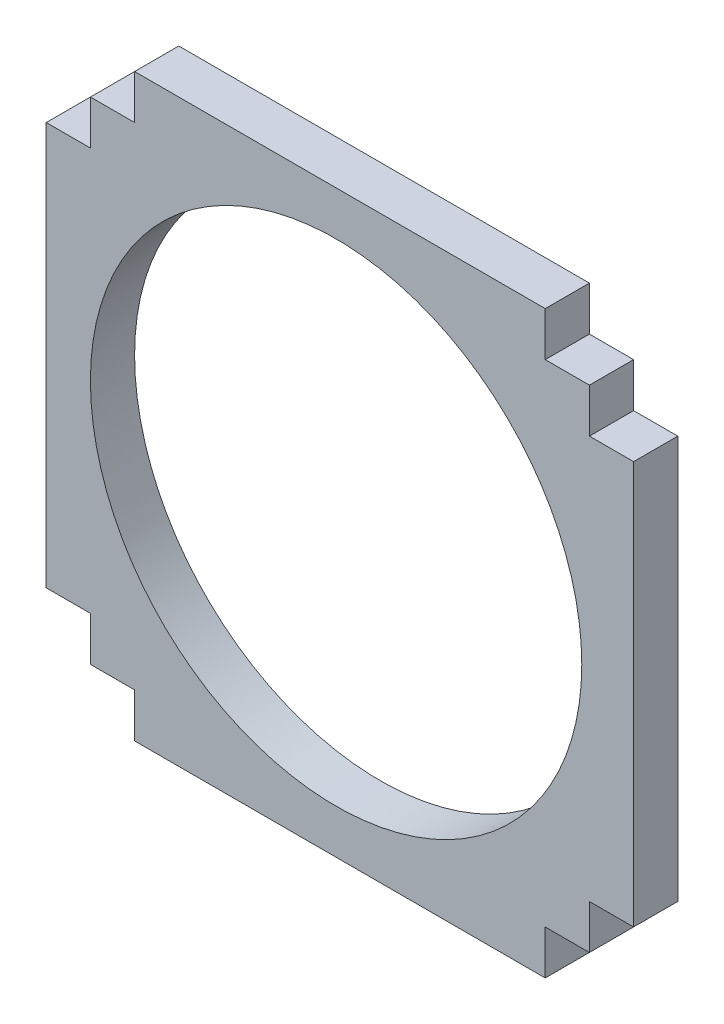
from build123d import *

# Parameters (mm, degrees)
SKETCH1_R           = 35.3139375
BOSS_EXTRUDE1_DEPTH = 6.35


with BuildPart() as part:
    # Sketch1 → Boss-Extrude1 (new body)
    with BuildSketch(Plane.XY):
        Polygon((36.4109, 35.3139375), (30.0609, 35.3139375), (30.0609, 41.6639375), (-28.9639375, 41.6639375), (-28.9639375, 35.3139375), (-35.3139375, 35.3139375), (-35.3139375, 28.9639375), (-41.6639375, 28.9639375), (-41.6639375, -28.9639375), (-35.3139375, -28.9639375), (-35.3139375, -35.3139375), (-28.9639375, -35.3139375), (-28.9639375, -41.6639375), (30.0609, -41.6639375), (30.0609, -35.3139375), (36.4109, -35.3139375), (36.4109, -28.9639375), (42.7609, -28.9639375), (42.7609, 28.9639375), (36.4109, 28.9639375), align=None)
        Circle(SKETCH1_R, mode=Mode.SUBTRACT)
    extrude(amount=-BOSS_EXTRUDE1_DEPTH)


solid = part.part
